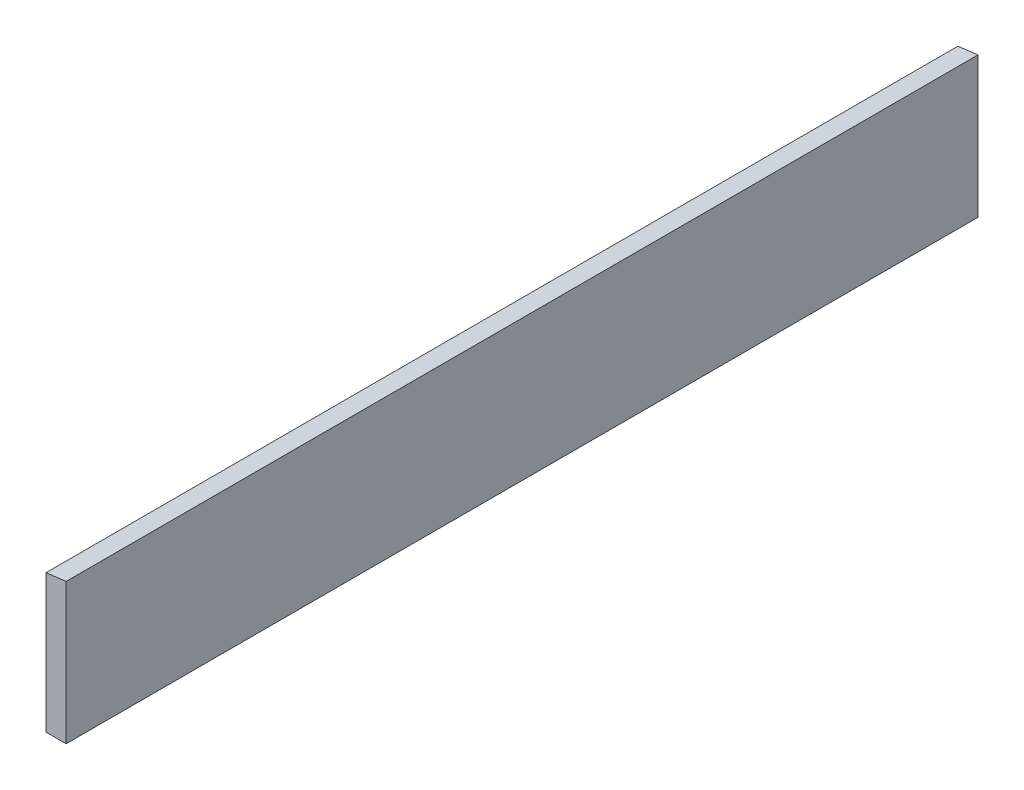
from build123d import *

# Parameters (mm, degrees)
BOSS_EXTRUDE1_DEPTH = 863.6


with BuildPart() as part:
    # Sketch1 → Boss-Extrude1 (new body)
    with BuildSketch(Plane.XY):
        Polygon((467.736295427, 158.013408708), (467.736295427, 27.19467147), (486.786295427, 27.19467147), (486.786295427, 160.396225774), align=None)
    extrude(amount=BOSS_EXTRUDE1_DEPTH)


solid = part.part
